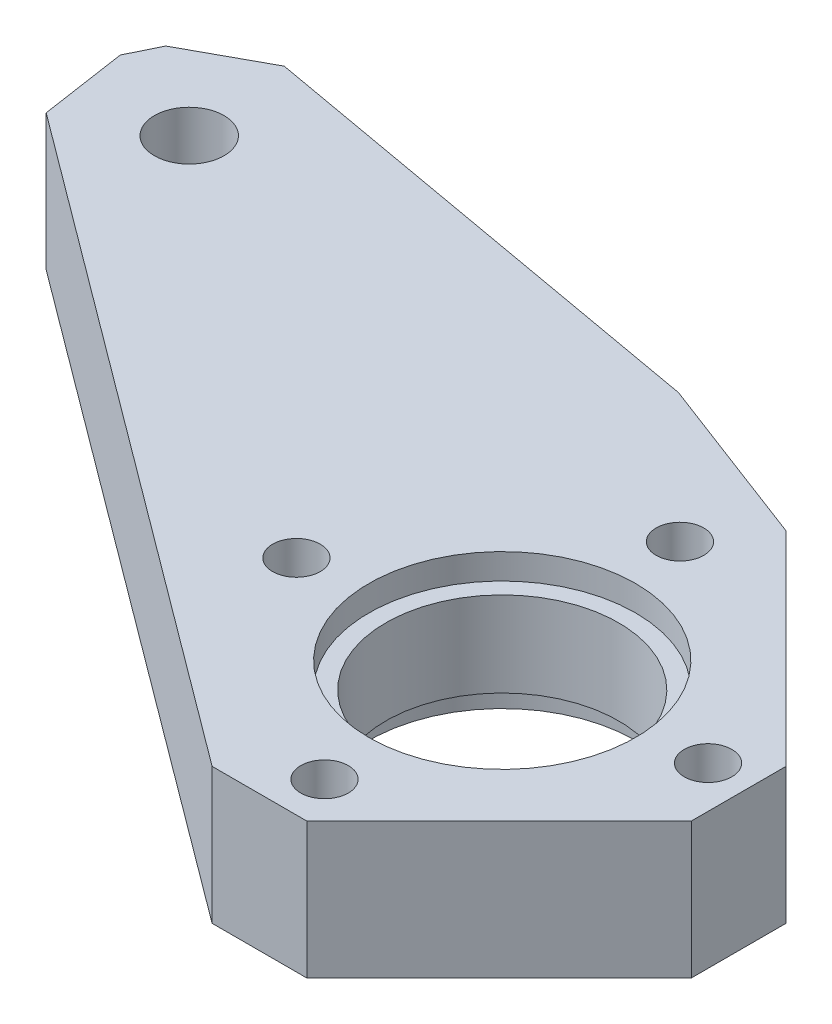
from build123d import *

# Parameters (mm, degrees)
BOSS_EXTRUDE1_DEPTH = 8
SKETCH2_R           = 2.05
SKETCH2_R_2         = 6.85
CUT_EXTRUDE1_DEPTH  = 8
SKETCH2_4_R         = 7.85
SKETCH2_4_R_2       = 6.85
CUT_EXTRUDE2_DEPTH  = 1.5
CUT_EXTRUDE3_START  = -6.5
SKETCH2_5_R         = 7.85
SKETCH2_5_R_2       = 6.85
SKETCH2_5_R_3       = 2.05
SKETCH2_5_R_4       = 1.4
CUT_EXTRUDE3_DEPTH  = 1.5
SKETCH2_6_R         = 1.4
CUT_EXTRUDE4_DEPTH  = 10


with BuildPart() as part:
    # Sketch1 → Boss-Extrude1 (new body)
    with BuildSketch(Plane(origin=(0, 0, 0), x_dir=(1, 0, 0), z_dir=(0, 1, 0))):
        Polygon((31.226142903, 7.08081886), (19.912434404, -4.232889639), (14.342434404, -4.232889639), (-23.841936683, 24.187416566), (-24.606695271, 29.310652291), (-23.730266729, 31.108393377), (-19.218269492, 33.568524054), (9.016403464, 28.534078393), (19.205327622, 24.661634141), (31.226142903, 12.64081886), align=None)
    extrude(amount=BOSS_EXTRUDE1_DEPTH)

    # Sketch2 → Cut-Extrude1 (cut)
    with BuildSketch(Plane(origin=(0, 8, 0), x_dir=(1, 0, 0), z_dir=(0, 1, 0))):
        with Locations((-18.468718365, 27.231371116)):
            Circle(SKETCH2_R)
        with Locations((17.48339004, 9.697235801)):
            Circle(SKETCH2_R_2)
    extrude(amount=-CUT_EXTRUDE1_DEPTH, mode=Mode.SUBTRACT)

    # Sketch2<4> → Cut-Extrude2 (cut)
    with BuildSketch(Plane(origin=(0, 8, 0), x_dir=(1, 0, 0), z_dir=(0, 1, 0))):
        with Locations((17.48339004, 9.697235801)):
            Circle(SKETCH2_4_R)
        with Locations((17.48339004, 9.697235801)):
            Circle(SKETCH2_4_R_2, mode=Mode.SUBTRACT)
    extrude(amount=-CUT_EXTRUDE2_DEPTH, mode=Mode.SUBTRACT)

    # Sketch2<5> → Cut-Extrude3 (cut)
    # profile 1 of 6: a face of its own
    with BuildSketch(Plane(origin=(0, 8, 0), x_dir=(1, 0, 0), z_dir=(0, 1, 0)).offset(CUT_EXTRUDE3_START)):
        with Locations((17.48339004, 9.697235801)):
            Circle(SKETCH2_5_R)
        with Locations((17.48339004, 9.697235801)):
            Circle(SKETCH2_5_R_2, mode=Mode.SUBTRACT)
    # profile 2 of 6: a face of its own
    with BuildSketch(Plane(origin=(0, 8, 0), x_dir=(1, 0, 0), z_dir=(0, 1, 0)).offset(CUT_EXTRUDE3_START)):
        with Locations((-18.468718365, 27.231371116)):
            Circle(SKETCH2_5_R_3)
    # profile 3 of 6: a face of its own
    with BuildSketch(Plane(origin=(0, 8, 0), x_dir=(1, 0, 0), z_dir=(0, 1, 0)).offset(CUT_EXTRUDE3_START)):
        with Locations((16.657298103, 20.980744657)):
            Circle(SKETCH2_5_R_4)
    # profile 4 of 6: a face of its own
    with BuildSketch(Plane(origin=(0, 8, 0), x_dir=(1, 0, 0), z_dir=(0, 1, 0)).offset(CUT_EXTRUDE3_START)):
        with Locations((28.766898896, 10.523327737)):
            Circle(SKETCH2_5_R_4)
    # profile 5 of 6: a face of its own
    with BuildSketch(Plane(origin=(0, 8, 0), x_dir=(1, 0, 0), z_dir=(0, 1, 0)).offset(CUT_EXTRUDE3_START)):
        with Locations((6.199881183, 8.871143864)):
            Circle(SKETCH2_5_R_4)
    # profile 6 of 6: a face of its own
    with BuildSketch(Plane(origin=(0, 8, 0), x_dir=(1, 0, 0), z_dir=(0, 1, 0)).offset(CUT_EXTRUDE3_START)):
        with Locations((18.309481976, -1.586273056)):
            Circle(SKETCH2_5_R_4)
    extrude(amount=-CUT_EXTRUDE3_DEPTH, mode=Mode.SUBTRACT)

    # Sketch2<6> → Cut-Extrude4 (cut)
    with BuildSketch(Plane(origin=(0, 8, 0), x_dir=(1, 0, 0), z_dir=(0, 1, 0))):
        with Locations((16.657298103, 20.980744657)):
            Circle(SKETCH2_6_R)
        with Locations((28.766898896, 10.523327737)):
            Circle(SKETCH2_6_R)
        with Locations((6.199881183, 8.871143864)):
            Circle(SKETCH2_6_R)
        with Locations((18.309481976, -1.586273056)):
            Circle(SKETCH2_6_R)
    extrude(amount=-CUT_EXTRUDE4_DEPTH, mode=Mode.SUBTRACT)


solid = part.part
